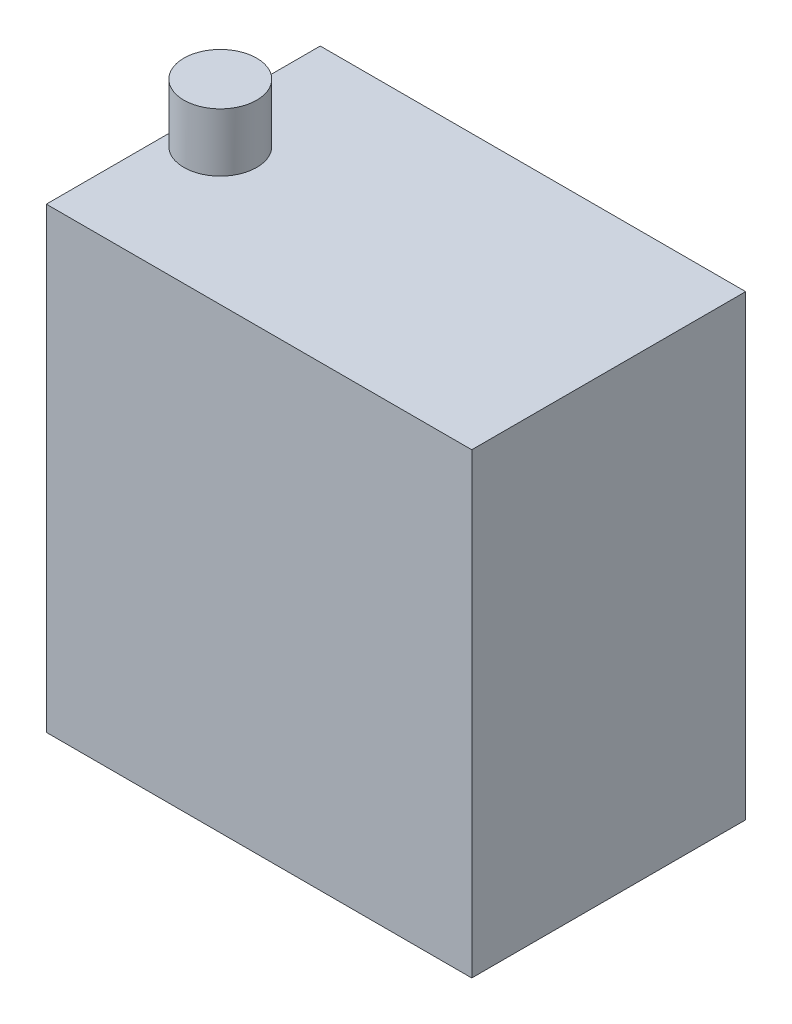
from build123d import *

# Parameters (mm, degrees)
SKETCH1_W           = 73
SKETCH1_H           = 47
BOSS_EXTRUDE1_DEPTH = 78.5
SKETCH2_R           = 6.25
BOSS_EXTRUDE2_DEPTH = 10
CUT_EXTRUDE1_DEPTH  = 10


with BuildPart() as part:
    # Sketch1 → Boss-Extrude1 (new body)
    with BuildSketch(Plane(origin=(0, 0, 0), x_dir=(1, 0, 0), z_dir=(0, 1, 0))):
        with Locations((36.5, 23.5)):
            Rectangle(SKETCH1_W, SKETCH1_H)
    extrude(amount=BOSS_EXTRUDE1_DEPTH)

    # Sketch2 → Boss-Extrude2 (add)
    with BuildSketch(Plane(origin=(0, 78.5, 0), x_dir=(1, 0, 0), z_dir=(0, 1, 0))):
        with Locations(Location((6.35, 23.5, 0), (0, 0, 90))):
            Circle(SKETCH2_R)
    extrude(amount=BOSS_EXTRUDE2_DEPTH)

    # Sketch3 → Cut-Extrude1 (cut)
    with BuildSketch(Plane.ZY):
        with BuildLine():
            ThreePointArc((-21.329397779, 32.310096913), (-22.410553216, 32.452433726), (-23.5, 32.5))
            Line((-23.5, 32.5), (-23.5, 23.75))
            ThreePointArc((-23.5, 23.75), (-23.173165965, 23.735730118), (-22.848819334, 23.693029074))
            Line((-22.848819334, 23.693029074), (-21.329397779, 32.310096913))
        make_face()
        with BuildLine():
            Line((-23.5, 23.75), (-23.5, 32.5))
            ThreePointArc((-23.5, 32.5), (-24.589446784, 32.452433726), (-25.670602221, 32.310096913))
            Line((-25.670602221, 32.310096913), (-24.151180666, 23.693029074))
            ThreePointArc((-24.151180666, 23.693029074), (-23.826834035, 23.735730118), (-23.5, 23.75))
        make_face()
        with BuildLine():
            Line((-18.020360665, 31.234925579), (-21.8561082, 23.370477674))
            ThreePointArc((-21.8561082, 23.370477674), (-21.295805304, 23.033813729), (-20.802475749, 22.604968889))
            Line((-20.802475749, 22.604968889), (-14.508252496, 28.683229631))
            ThreePointArc((-14.508252496, 28.683229631), (-16.152684346, 30.11271243), (-18.020360665, 31.234925579))
        make_face()
        with BuildLine():
            Line((-12.463155089, 25.868394535), (-20.188946527, 21.76051836))
            ThreePointArc((-20.188946527, 21.76051836), (-19.933538064, 21.158813729), (-19.786494742, 20.521899129))
            Line((-19.786494742, 20.521899129), (-11.121649141, 21.739663762))
            ThreePointArc((-11.121649141, 21.739663762), (-11.611793546, 23.86271243), (-12.463155089, 25.868394535))
        make_face()
        with BuildLine():
            Line((-11.121649141, 18.260336238), (-19.786494742, 19.478100871))
            ThreePointArc((-19.786494742, 19.478100871), (-19.933538064, 18.841186271), (-20.188946527, 18.23948164))
            Line((-20.188946527, 18.23948164), (-12.463155089, 14.131605465))
            ThreePointArc((-12.463155089, 14.131605465), (-11.611793546, 16.13728757), (-11.121649141, 18.260336238))
        make_face()
        with BuildLine():
            Line((-21.8561082, 16.629522326), (-18.020360665, 8.765074421))
            ThreePointArc((-18.020360665, 8.765074421), (-16.152684346, 9.88728757), (-14.508252496, 11.316770369))
            Line((-14.508252496, 11.316770369), (-20.802475749, 17.395031111))
            ThreePointArc((-20.802475749, 17.395031111), (-21.295805304, 16.966186271), (-21.8561082, 16.629522326))
        make_face()
        with BuildLine():
            Line((-23.5, 16.25), (-23.5, 7.5))
            ThreePointArc((-23.5, 7.5), (-22.410553216, 7.547566274), (-21.329397779, 7.689903087))
            Line((-21.329397779, 7.689903087), (-22.848819334, 16.306970926))
            ThreePointArc((-22.848819334, 16.306970926), (-23.173165965, 16.264269882), (-23.5, 16.25))
        make_face()
        with BuildLine():
            ThreePointArc((-25.670602221, 7.689903087), (-24.589446784, 7.547566274), (-23.5, 7.5))
            Line((-23.5, 7.5), (-23.5, 16.25))
            ThreePointArc((-23.5, 16.25), (-23.826834035, 16.264269882), (-24.151180666, 16.306970926))
            Line((-24.151180666, 16.306970926), (-25.670602221, 7.689903087))
        make_face()
        with BuildLine():
            ThreePointArc((-32.491747504, 11.316770369), (-30.847315654, 9.88728757), (-28.979639335, 8.765074421))
            Line((-28.979639335, 8.765074421), (-25.1438918, 16.629522326))
            ThreePointArc((-25.1438918, 16.629522326), (-25.704194696, 16.966186271), (-26.197524251, 17.395031111))
            Line((-26.197524251, 17.395031111), (-32.491747504, 11.316770369))
        make_face()
        with BuildLine():
            Line((-34.536844911, 14.131605465), (-26.811053473, 18.23948164))
            ThreePointArc((-26.811053473, 18.23948164), (-27.066461936, 18.841186271), (-27.213505258, 19.478100871))
            Line((-27.213505258, 19.478100871), (-35.878350859, 18.260336238))
            ThreePointArc((-35.878350859, 18.260336238), (-35.388206454, 16.13728757), (-34.536844911, 14.131605465))
        make_face()
        with BuildLine():
            Line((-35.878350859, 21.739663762), (-27.213505258, 20.521899129))
            ThreePointArc((-27.213505258, 20.521899129), (-27.066461936, 21.158813729), (-26.811053473, 21.76051836))
            Line((-26.811053473, 21.76051836), (-34.536844911, 25.868394535))
            ThreePointArc((-34.536844911, 25.868394535), (-35.388206454, 23.86271243), (-35.878350859, 21.739663762))
        make_face()
        with BuildLine():
            Line((-32.491747504, 28.683229631), (-26.197524251, 22.604968889))
            ThreePointArc((-26.197524251, 22.604968889), (-25.704194696, 23.033813729), (-25.1438918, 23.370477674))
            Line((-25.1438918, 23.370477674), (-28.979639335, 31.234925579))
            ThreePointArc((-28.979639335, 31.234925579), (-30.847315654, 30.11271243), (-32.491747504, 28.683229631))
        make_face()
    extrude(amount=-CUT_EXTRUDE1_DEPTH, mode=Mode.SUBTRACT)


solid = part.part
